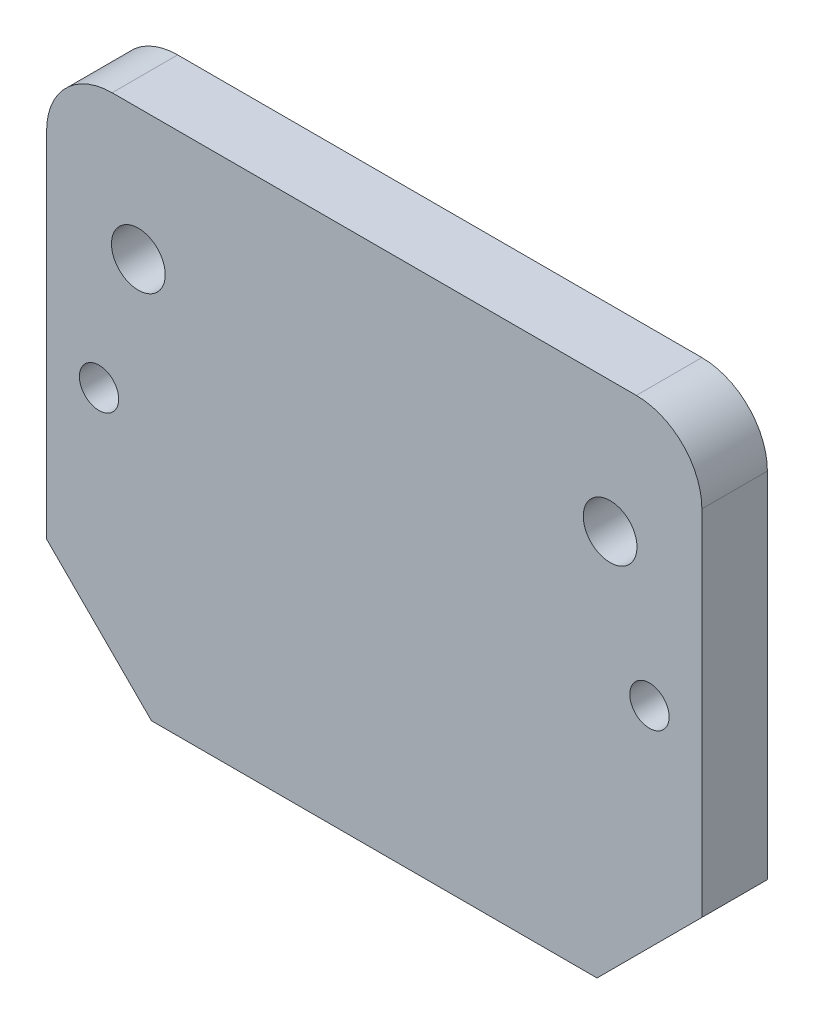
from build123d import *

# Parameters (mm, degrees)
BOSS_EXTRU_1_DEPTH           = 5
ENL_V_MAT_EXTRU_2_DEPTH      = 59.215118311
ENL_V_MAT_EXTRU_2_DEPTH_BACK = 59.215118311
ESQUISSE3_R                  = 1.5
ESQUISSE3_R_2                = 2.05
CONG_1_R                     = 5


with BuildPart() as part:
    # Esquisse1 → Boss.-Extru.1 (new body)
    with BuildSketch(Plane.XY):
        Polygon((0, 0), (-8, 8), (-8, 40), (42, 40), (42, 8), (34, 0), align=None)
    extrude(amount=BOSS_EXTRU_1_DEPTH)

    # Esquisse3 → Enlèv. mat.-Extru.2 (cut, two sides: drawn at the far end of the back side and taken through both)
    with BuildSketch(Plane(origin=(0, 0, 0), x_dir=(-1, 0, 0), z_dir=(0, 0, -1)).offset(-ENL_V_MAT_EXTRU_2_DEPTH_BACK)):
        with Locations((4, 20)):
            Circle(ESQUISSE3_R)
        with Locations(Location((-38, 20, 0), (0, 0, 180))):
            Circle(ESQUISSE3_R)
        with Locations((-35, 30)):
            Circle(ESQUISSE3_R_2)
        with Locations(Location((1, 30, 0), (0, 0, 180))):
            Circle(ESQUISSE3_R_2)
    extrude(amount=ENL_V_MAT_EXTRU_2_DEPTH + ENL_V_MAT_EXTRU_2_DEPTH_BACK, mode=Mode.SUBTRACT)

    # Congé1
    cong_1_edges = [part.edges().sort_by_distance(p)[0] for p in [
        (-8, 40, 2.5),
        (42, 40, 2.5),
    ]]
    fillet(cong_1_edges, radius=CONG_1_R)


solid = part.part
